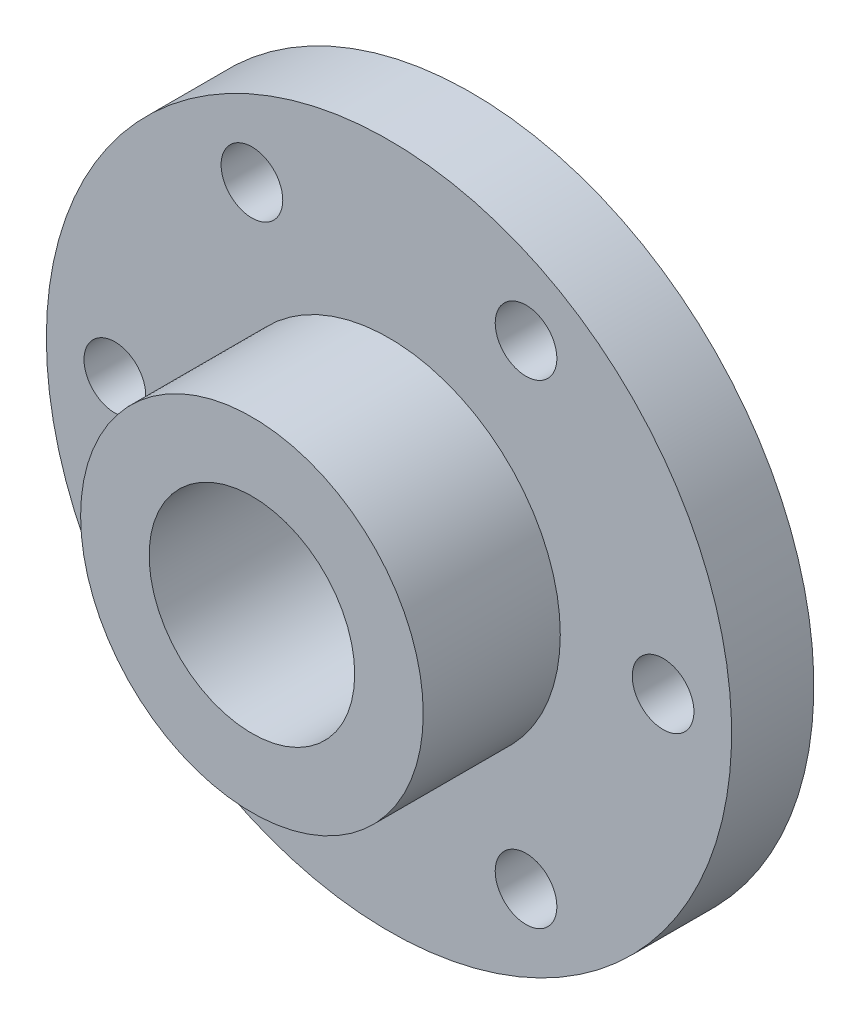
from build123d import *

# Parameters (mm, degrees)
SKETCH_2_R          = 15
CUT_EXTRUDE_1_DEPTH = 78.614431648
SKETCH_3_R          = 35
CUT_EXTRUDE_2_DEPTH = 3
SKETCH_4_R          = 4.5
CUT_EXTRUDE_3_DEPTH = 78.614431648


with BuildPart() as part:
    # 草图1 → 旋转1 (revolve)
    with BuildSketch(Plane(origin=(0, 0, 0), x_dir=(1, 0, 0), z_dir=(0, 1, 0)), mode=Mode.PRIVATE) as revolve_1_sk:
        Polygon((0, 0), (50, 0), (50, -12), (25, -12), (25, -32), (0, -32), align=None)
    revolve(revolve_1_sk.sketch.rotate(Axis((0, 0, 0), (0, 0, 1)), 180), axis=Axis((0, 0, 0), (0, 0, 1)))

    # 草图2 → 切除-拉伸1 (cut, through all)
    with BuildSketch(Plane.XY):
        Circle(SKETCH_2_R)
    extrude(amount=CUT_EXTRUDE_1_DEPTH, mode=Mode.SUBTRACT)

    # 草图3 → 切除-拉伸2 (cut)
    with BuildSketch(Plane.XY):
        Circle(SKETCH_3_R)
    extrude(amount=CUT_EXTRUDE_2_DEPTH, mode=Mode.SUBTRACT)

    # 草图4 → 切除-拉伸3 (cut, through all)
    with BuildSketch(Plane.XY.offset(32)):
        with Locations((40, 0)):
            Circle(SKETCH_4_R)
        with Locations((20, 34.641016)):
            Circle(SKETCH_4_R)
        with Locations((-20, 34.641016)):
            Circle(SKETCH_4_R)
        with Locations((-40, 0)):
            Circle(SKETCH_4_R)
        with Locations((-20, -34.641016)):
            Circle(SKETCH_4_R)
        with Locations((20, -34.641016)):
            Circle(SKETCH_4_R)
    extrude(amount=-CUT_EXTRUDE_3_DEPTH, mode=Mode.SUBTRACT)


solid = part.part
